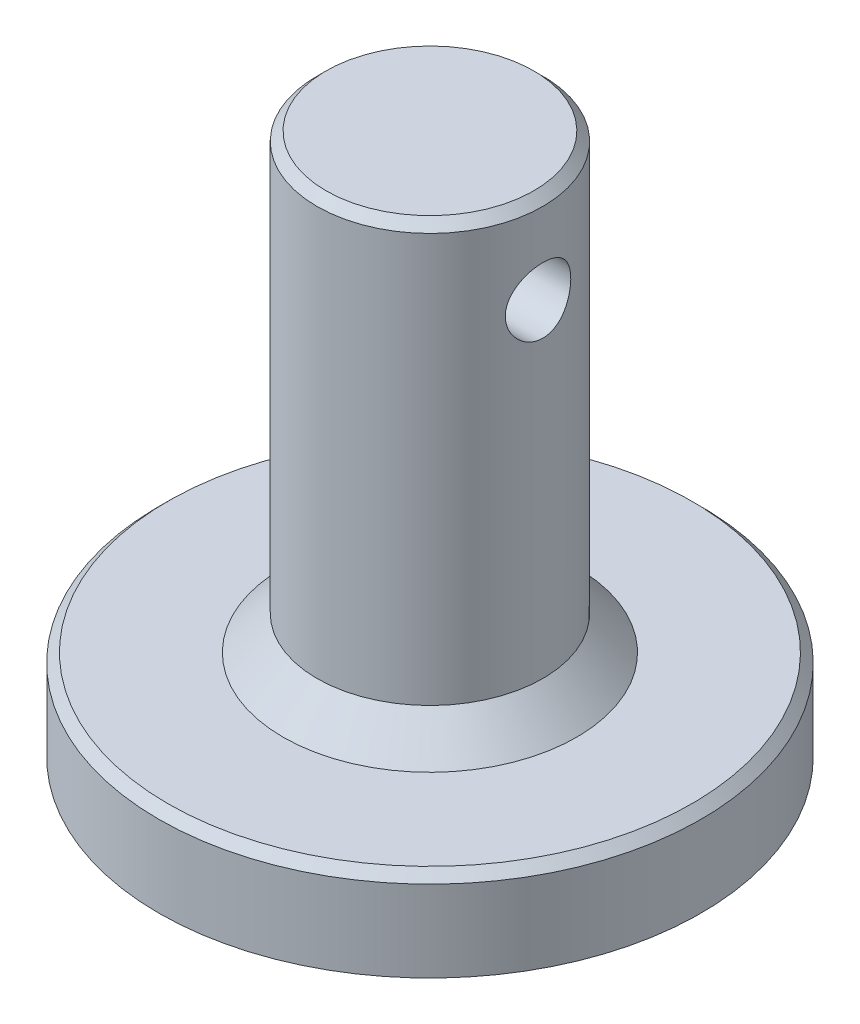
from build123d import *

# Parameters (mm, degrees)
SKETCH_1_R               = 12
EXTRUDE_1_DEPTH          = 4
SKETCH_2_R               = 5
EXTRUDE_2_DEPTH          = 20
CHAMFER_1_SIZE           = 0.4
CUT_EXTRUDE_1_DEPTH      = 30.393876913
CUT_EXTRUDE_1_DEPTH_BACK = 30.393876913
SKETCH_4_R               = 1.45
CHAMFER_2_SIZE           = 1.5


with BuildPart() as part:
    # 草图1 → 凸台-拉伸1 (new body)
    with BuildSketch(Plane(origin=(0, 0, 0), x_dir=(1, 0, 0), z_dir=(0, 1, 0))):
        with Locations(Location((0, 0, 0), (0, 0, 270))):
            Circle(SKETCH_1_R)
    extrude(amount=EXTRUDE_1_DEPTH)

    # 草图2 → 凸台-拉伸2 (add)
    with BuildSketch(Plane(origin=(0, 4, 0), x_dir=(1, 0, 0), z_dir=(0, 1, 0))):
        with Locations(Location((0, 0, 0), (0, 0, 270))):
            Circle(SKETCH_2_R)
    extrude(amount=EXTRUDE_2_DEPTH)

    # 倒角1
    chamfer_1_edges = [part.edges().sort_by_distance(p)[0] for p in [
        (0, 4, -12),
        (0, 24, -5),
    ]]
    chamfer(chamfer_1_edges, length=CHAMFER_1_SIZE)

    # 草图4 → 切除-拉伸1 (cut, two sides: drawn at the far end of the back side and taken through both)
    with BuildSketch(Plane(origin=(0, 0, 0), x_dir=(0, 0, -1), z_dir=(1, 0, 0)).offset(-CUT_EXTRUDE_1_DEPTH_BACK)):
        with Locations(Location((0, 20, 0), (0, 0, 180))):
            Circle(SKETCH_4_R)
    extrude(amount=CUT_EXTRUDE_1_DEPTH + CUT_EXTRUDE_1_DEPTH_BACK, mode=Mode.SUBTRACT)

    # 倒角2
    chamfer_2_edges = [part.edges().sort_by_distance(p)[0] for p in [
        (0, 4, -5),
    ]]
    chamfer(chamfer_2_edges, length=CHAMFER_2_SIZE)


solid = part.part
